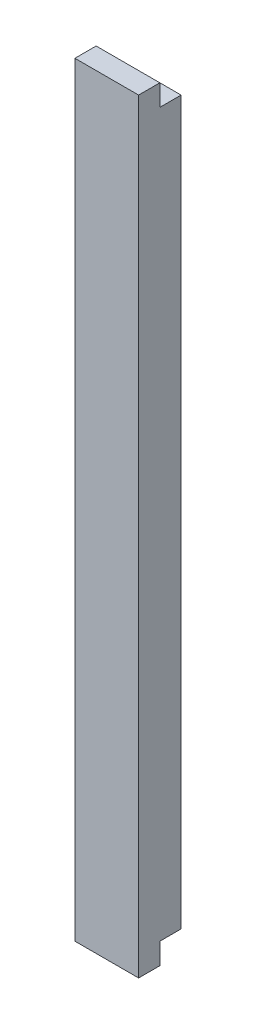
from build123d import *

# Parameters (mm, degrees)
SKETCH1_W           = 40
SKETCH1_H           = 360
BOSS_EXTRUDE1_DEPTH = 20
SKETCH2_W           = 10
SKETCH2_H           = 360
CUT_EXTRUDE1_DEPTH  = 10
SKETCH3_W           = 40
SKETCH3_H           = 10
CUT_EXTRUDE2_DEPTH  = 10


with BuildPart() as part:
    # Sketch1 → Boss-Extrude1 (new body)
    with BuildSketch(Plane.XY):
        Rectangle(SKETCH1_W, SKETCH1_H)
    extrude(amount=BOSS_EXTRUDE1_DEPTH)

    # Sketch2 → Cut-Extrude1 (cut)
    with BuildSketch(Plane.XY.offset(20)):
        with Locations((-15, 0)):
            Rectangle(SKETCH2_W, SKETCH2_H)
    extrude(amount=-CUT_EXTRUDE1_DEPTH, mode=Mode.SUBTRACT)

    # Sketch3 → Cut-Extrude2 (cut)
    with BuildSketch(Plane(origin=(0, 0, 0), x_dir=(-1, 0, 0), z_dir=(0, 0, -1))):
        with Locations((0, 175)):
            Rectangle(SKETCH3_W, SKETCH3_H)
        with Locations((0, -175)):
            Rectangle(SKETCH3_W, SKETCH3_H)
    extrude(amount=-CUT_EXTRUDE2_DEPTH, mode=Mode.SUBTRACT)


solid = part.part
